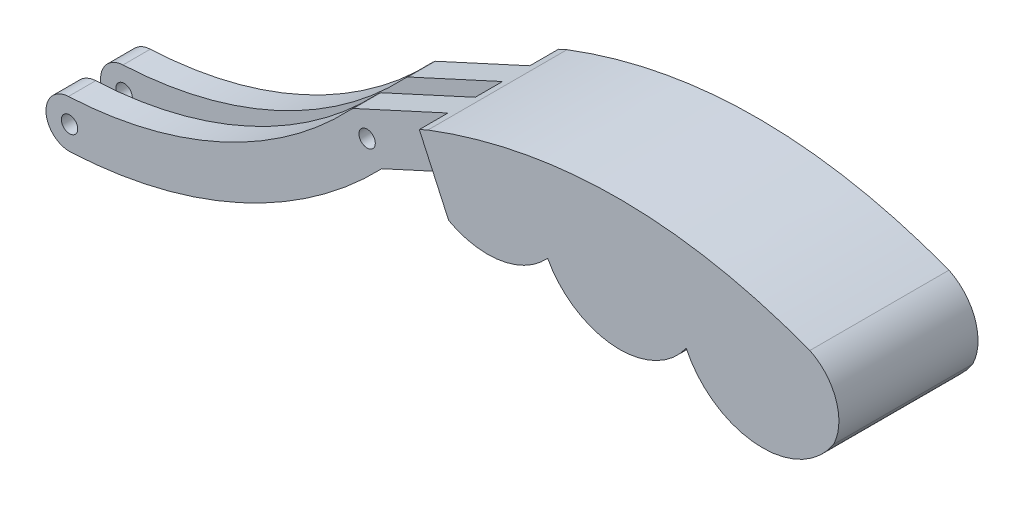
from build123d import *

# Parameters (mm, degrees)
CROQUIS1_R                 = 3
SALIENTE_EXTRUIR1_DEPTH    = 51
CORTAR_EXTRUIR1_DEPTH      = 311.888957589
CORTAR_EXTRUIR1_DEPTH_BACK = 311.888957589
CROQUIS2_W                 = 181.964548074
CROQUIS2_H                 = 27.905532643
CROQUIS2_W_2               = 174.878216902
CROQUIS2_H_2               = 60.347618799
CROQUIS2_W_3               = 330
CROQUIS2_H_3               = 10


with BuildPart() as part:
    # Croquis1 → Saliente-Extruir1 (new body)
    # profile 1 of 4: a face of its own
    with BuildSketch(Plane.XY):
        with BuildLine():
            Line((141.907724078, 74.393898239), (106.962723162, 58.37688333))
            ThreePointArc((106.962723162, 58.37688333), (116.54115135, 54.372948072), (115.362717192, 44.058439988))
            ThreePointArc((115.362717192, 44.058439988), (114.912044927, 43.584270047), (114.45954291, 43.111845929))
            Line((114.45954291, 43.111845929), (141.660745717, 55.579496794))
            ThreePointArc((141.660745717, 55.579496794), (163.715018222, 45.838294791), (185.769290727, 55.579496794))
            ThreePointArc((185.769290727, 55.579496794), (210.289811625, 39.891989826), (236.56917478, 52.411929606))
            ThreePointArc((236.56917478, 52.411929606), (262.563049751, 34.849044969), (290.598242925, 48.926132611))
            ThreePointArc((290.598242925, 48.926132611), (291.527530464, 63.45988081), (281.907724078, 74.393898239))
            add(Edge.make_bspline(
                [(141.907724078, 74.393898239), (211.705167047, 100.839206128), (281.907724078, 74.393898239)],
                knots=[0, 0, 0, 1, 1, 1], degree=2))
        make_face()
    # profile 2 of 4: a face of its own
    with BuildSketch(Plane.XY):
        with BuildLine():
            ThreePointArc((105.545350362, 57.727231572), (116.814352718, 53.541770784), (112.62889193, 42.272768428))
            Line((112.62889193, 42.272768428), (114.45954291, 43.111845929))
            ThreePointArc((114.45954291, 43.111845929), (114.912044927, 43.584270047), (115.362717192, 44.058439988))
            ThreePointArc((115.362717192, 44.058439988), (116.54115135, 54.372948072), (106.962723162, 58.37688333))
            Line((106.962723162, 58.37688333), (105.545350362, 57.727231572))
        make_face()
    # profile 3 of 4: a face of its own
    with BuildSketch(Plane.XY):
        with BuildLine():
            Line((-2.124397984, 8.37688333), (-3.541770784, 7.727231572))
            ThreePointArc((-3.541770784, 7.727231572), (-7.727231572, -3.541770784), (3.541770784, -7.727231572))
            Line((3.541770784, -7.727231572), (112.62889193, 42.272768428))
            ThreePointArc((112.62889193, 42.272768428), (116.814352718, 53.541770784), (105.545350362, 57.727231572))
            Line((105.545350362, 57.727231572), (104.127977562, 57.077579814))
            ThreePointArc((104.127977562, 57.077579814), (103.441106721, 56.542764112), (102.8115251, 55.941560012))
            ThreePointArc((102.8115251, 55.941560012), (55.789043947, 22.282676087), (-0.404455893, 8.63259269))
            ThreePointArc((-0.404455893, 8.63259269), (-1.270874621, 8.548106154), (-2.124397984, 8.37688333))
        make_face()
        Circle(CROQUIS1_R, mode=Mode.SUBTRACT)
        with Locations((109.087121146, 50)):
            Circle(CROQUIS1_R, mode=Mode.SUBTRACT)
    # profile 4 of 4: a face of its own
    with BuildSketch(Plane.XY):
        with BuildLine():
            ThreePointArc((3.541770784, -7.727231572), (-7.727231572, -3.541770784), (-3.541770784, 7.727231572))
            Line((-3.541770784, 7.727231572), (-2.124397984, 8.37688333))
            ThreePointArc((-2.124397984, 8.37688333), (-8.548106154, -1.270874621), (0.404455893, -8.63259269))
            ThreePointArc((0.404455893, -8.63259269), (62.395554487, 6.298958939), (114.45954291, 43.111845929))
            Line((114.45954291, 43.111845929), (112.62889193, 42.272768428))
            Line((112.62889193, 42.272768428), (3.541770784, -7.727231572))
        make_face()
    extrude(amount=SALIENTE_EXTRUIR1_DEPTH)

    # Croquis2 → Cortar-Extruir1 (cut, two sides: drawn at the far end of the back side and taken through both)
    with BuildSketch(Plane(origin=(-3.541770784, 7.727231572, 0), x_dir=(0.9090593428863096, 0.4166666666666667, 0), z_dir=(-0.41666666666666663, 0.9090593428863095, 0)).offset(-CORTAR_EXTRUIR1_DEPTH_BACK)):
        with Locations((65.517476081, 3.452766322)):
            Rectangle(CROQUIS2_W, CROQUIS2_H)
        with Locations((69.060641667, -70.6738094)):
            Rectangle(CROQUIS2_W_2, CROQUIS2_H_2)
        with Locations((-8.500249882, -25.5)):
            Rectangle(CROQUIS2_W_3, CROQUIS2_H_3)
    extrude(amount=CORTAR_EXTRUIR1_DEPTH + CORTAR_EXTRUIR1_DEPTH_BACK, mode=Mode.SUBTRACT)


solid = part.part
